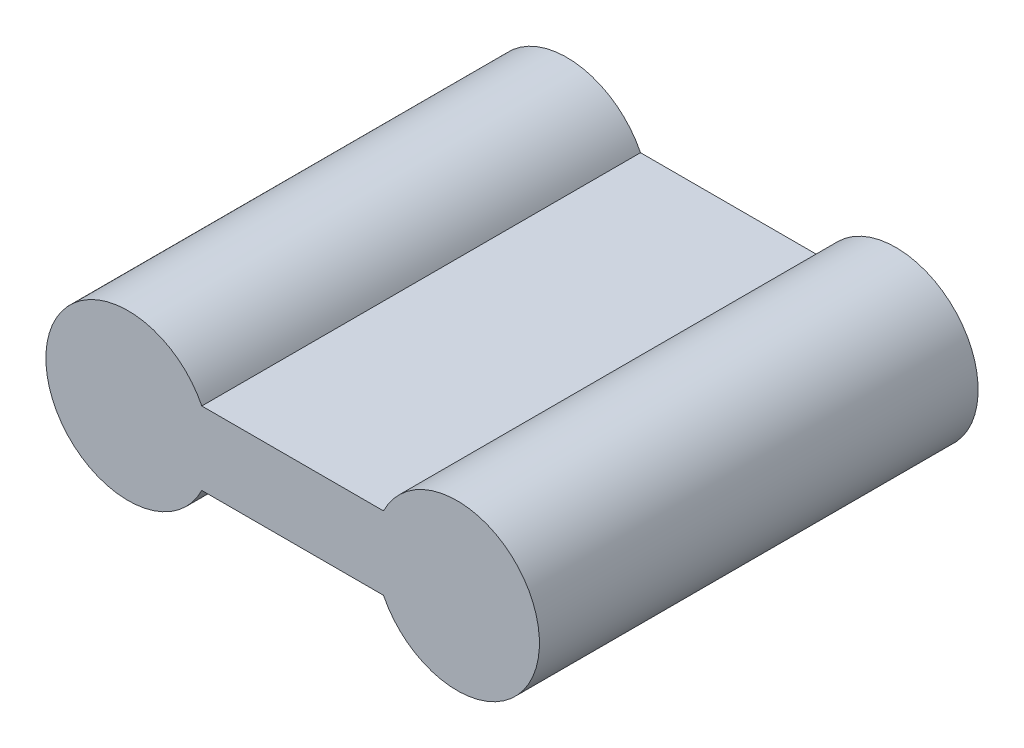
from build123d import *

# Parameters (mm, degrees)
BOSS_EXTRUDE1_DEPTH = 12


with BuildPart() as part:
    # Sketch1 → Boss-Extrude1 (new body)
    with BuildSketch(Plane.XY):
        with BuildLine():
            Line((2.015564437, 1), (6.984435563, 1))
            ThreePointArc((6.984435563, 1), (11.25, 0), (6.984435563, -1))
            Line((6.984435563, -1), (2.015564437, -1))
            ThreePointArc((2.015564437, -1), (-2.25, 0), (2.015564437, 1))
        make_face()
    extrude(amount=BOSS_EXTRUDE1_DEPTH)


solid = part.part
